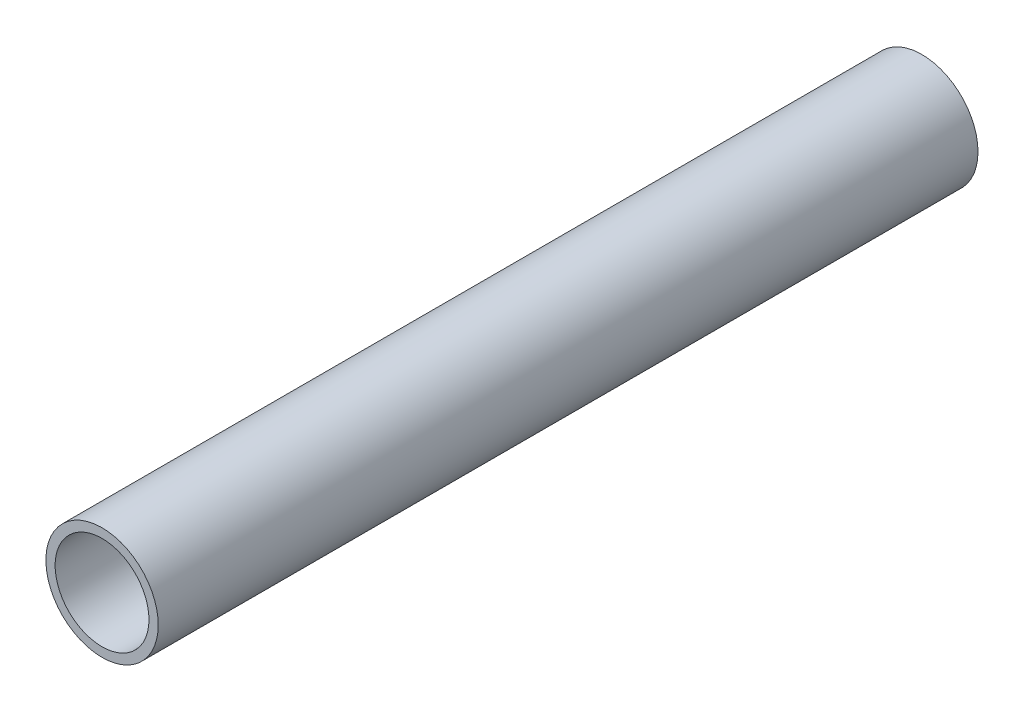
from build123d import *

# Parameters (mm, degrees)
SKETCH2_R           = 16.40988589
SKETCH2_R_2         = 13.710793866
BOSS_EXTRUDE1_DEPTH = 239.522


with BuildPart() as part:
    # Sketch2 → Boss-Extrude1 (new body)
    with BuildSketch(Plane.XY):
        Circle(SKETCH2_R)
        Circle(SKETCH2_R_2, mode=Mode.SUBTRACT)
    extrude(amount=BOSS_EXTRUDE1_DEPTH)


solid = part.part
